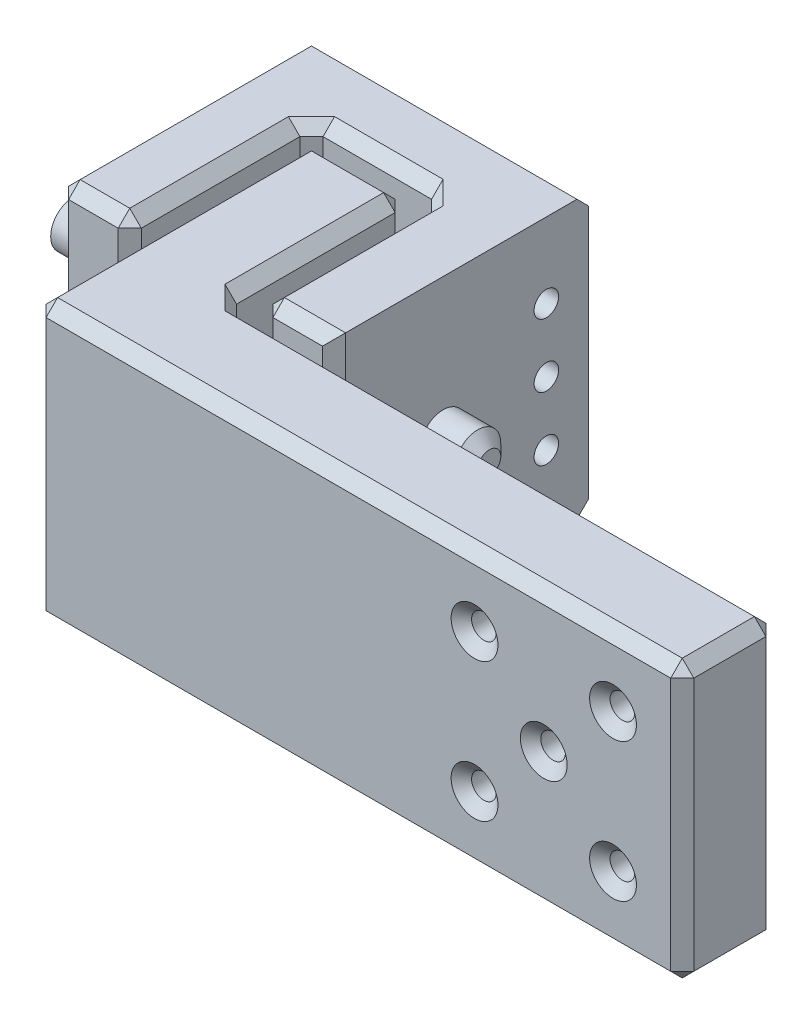
from build123d import *

# Parameters (mm, degrees)
BOSS_EXTRUDE1_DEPTH                            = 76.2
BOSS_EXTRUDE1_2_DEPTH                          = 76.2
CUT_EXTRUDE1_DEPTH                             = 229.027805322
CUT_EXTRUDE1_DEPTH_BACK                        = 229.027805322
SKETCH3_R                                      = 6.35
CHAMFER1_SIZE                                  = 6.35
CHAMFER2_SIZE                                  = 3.175
CHAMFER3_SIZE                                  = 3.175
CHAMFER4_SIZE                                  = 3.175
CSK_FOR_1_4_FLAT_HEAD_MACHINE_SCREW_2_COUNT    = 2
CSK_FOR_1_4_FLAT_HEAD_MACHINE_SCREW_2_PITCH    = 26.940768363
CSK_FOR_1_4_FLAT_HEAD_MACHINE_SCREW_3_COUNT    = 2
CSK_FOR_1_4_FLAT_HEAD_MACHINE_SCREW_3_PITCH    = 38.1
CSK_FOR_1_4_FLAT_HEAD_MACHINE_SCREW_4_COUNT    = 2
CSK_FOR_1_4_FLAT_HEAD_MACHINE_SCREW_4_PITCH    = 53.881536726
CSK_FOR_1_4_FLAT_HEAD_MACHINE_SCREW_5_COUNT    = 2
CSK_FOR_1_4_FLAT_HEAD_MACHINE_SCREW_5_PITCH    = 38.1
SKETCH7_R                                      = 6.35
BOSS_EXTRUDE2_DEPTH                            = 88.9
BOSS_EXTRUDE3_START                            = 25.4
SKETCH7_2_R                                    = 6.35
BOSS_EXTRUDE3_DEPTH                            = 25.4
CSK_FOR_1_4_FLAT_HEAD_MACHINE_SCREW_6_AT_COUNT = 2
CSK_FOR_1_4_FLAT_HEAD_MACHINE_SCREW_6_AT_PITCH = 17.4625
CSK_FOR_1_4_FLAT_HEAD_MACHINE_SCREW_7_COUNT    = 2
CSK_FOR_1_4_FLAT_HEAD_MACHINE_SCREW_7_PITCH    = 34.925
CHAMFER5_SIZE                                  = 3.175


with BuildPart() as part:
    # Sketch1 → Boss-Extrude1 (new body)
    with BuildSketch(Plane(origin=(0, 0, 0), x_dir=(1, 0, 0), z_dir=(0, 1, 0))):
        Polygon((0, 0), (0, 50), (36.2, 50), (36.2, 0), (56.2, 0), (56.2, 70), (-20, 70), (-20, 0), align=None)
    extrude(amount=BOSS_EXTRUDE1_DEPTH)


with BuildPart() as body_2:
    # Sketch1 → Boss-Extrude1 2 (new body)
    with BuildSketch(Plane(origin=(0, 0, 0), x_dir=(1, 0, 0), z_dir=(0, 1, 0))):
        Polygon((31.2, 45), (5, 45), (5, -31.2), (183.2, -31.2), (183.2, -5), (31.2, -5), align=None)
    extrude(amount=BOSS_EXTRUDE1_2_DEPTH)


with BuildPart() as cut_extrude1_tool:
    # Sketch3 → Cut-Extrude1 (new, two sides: drawn at the far end of the back side and taken through both)
    with BuildSketch(Plane.ZY.offset(20).offset(-CUT_EXTRUDE1_DEPTH_BACK)):
        with Locations((-30, 38.1)):
            Circle(SKETCH3_R)
    extrude(amount=CUT_EXTRUDE1_DEPTH + CUT_EXTRUDE1_DEPTH_BACK)


with BuildPart() as part_1:
    add(part.part)

    # Cut-Extrude1: cut by cut_extrude1_tool
    add(cut_extrude1_tool.part, mode=Mode.SUBTRACT)

    # Chamfer1
    chamfer1_edges = [part_1.edges().sort_by_distance(p)[0] for p in [
        (-20, 38.1, -36.35),
    ]]
    chamfer(chamfer1_edges, length=CHAMFER1_SIZE)

    # Chamfer3
    chamfer3_edges = [part_1.edges().sort_by_distance(p)[0] for p in [
        (36.2, 38.1, -36.35),
    ]]
    chamfer(chamfer3_edges, length=CHAMFER3_SIZE)

    # Chamfer4
    chamfer4_edges = [part_1.edges().sort_by_distance(p)[0] for p in [
        (36.2, 0, -25),
        (18.1, 0, -50),
        (0, 0, -25),
        (-10, 0, 0),
        (18.1, 76.2, -50),
        (-20, 38.1, 0),
        (-20, 38.1, -70),
        (56.2, 38.1, 0),
        (36.2, 38.1, 0),
        (36.2, 38.1, -50),
        (0, 38.1, -50),
        (0, 38.1, 0),
        (36.2, 76.2, -25),
        (46.2, 76.2, 0),
        (18.1, 76.2, -70),
        (-20, 76.2, -35),
        (-10, 76.2, 0),
        (-20, 0, -35),
        (0, 76.2, -25),
        (18.1, 0, -70),
        (46.2, 0, 0),
    ]]
    chamfer(chamfer4_edges, length=CHAMFER4_SIZE)

    # Sketch9 → CSK for 1_4 Flat Head Machine Screw  6 (revolve, cut)
    with BuildSketch(Plane(origin=(-20, 20.6375, -58.4125), x_dir=(0, 0, 1), z_dir=(0, 1, 0))):
        Polygon((0, 0), (0, 78.229827343), (3.3782, 76.2), (3.3782, 2.568232241), (6.4389, 0), align=None)
    csk_for_1_4_flat_head_machine_screw_6 = revolve(axis=Axis((-26.35, 20.6375, -58.4125), (1, 0, 0)), mode=Mode.SUBTRACT)

    # CSK for 1_4 Flat Head Machine Screw 6 at: CSK for 1_4 Flat Head Machine Screw  6 ×2
    with Locations(*[(0, i * CSK_FOR_1_4_FLAT_HEAD_MACHINE_SCREW_6_AT_PITCH, 0) for i in range(1, CSK_FOR_1_4_FLAT_HEAD_MACHINE_SCREW_6_AT_COUNT)]):
        add(csk_for_1_4_flat_head_machine_screw_6, mode=Mode.SUBTRACT)

    # CSK for 1_4 Flat Head Machine Screw  7: CSK for 1_4 Flat Head Machine Screw  6 ×2
    with Locations(*[(0, i * CSK_FOR_1_4_FLAT_HEAD_MACHINE_SCREW_7_PITCH, 0) for i in range(1, CSK_FOR_1_4_FLAT_HEAD_MACHINE_SCREW_7_COUNT)]):
        add(csk_for_1_4_flat_head_machine_screw_6, mode=Mode.SUBTRACT)


with BuildPart() as body_2_1:
    add(body_2.part)

    # Cut-Extrude1: cut by cut_extrude1_tool
    add(cut_extrude1_tool.part, mode=Mode.SUBTRACT)

    # Chamfer2
    chamfer2_edges = [body_2_1.edges().sort_by_distance(p)[0] for p in [
        (5, 38.1, -36.35),
        (31.2, 38.1, -36.35),
        (31.2, 0, -20),
        (18.1, 0, -45),
        (5, 0, -6.9),
        (94.1, 0, 31.2),
        (183.2, 0, 18.1),
        (107.2, 0, 5),
        (31.2, 76.2, -20),
        (18.1, 76.2, -45),
        (5, 76.2, -6.9),
        (94.1, 76.2, 31.2),
        (183.2, 76.2, 18.1),
        (107.2, 76.2, 5),
        (31.2, 38.1, 5),
        (183.2, 38.1, 5),
        (183.2, 38.1, 31.2),
        (5, 38.1, 31.2),
        (5, 38.1, -45),
        (31.2, 38.1, -45),
    ]]
    chamfer(chamfer2_edges, length=CHAMFER2_SIZE)

    # Sketch6 → CSK for 1_4 Flat Head Machine Screw _100 (revolve, cut)
    with BuildSketch(Plane(origin=(126.05, 19.05, 31.2), x_dir=(0, -1, 0), z_dir=(1, 0, 0))):
        Polygon((0, 0), (0, 28.229827343), (3.3782, 26.2), (3.3782, 2.568232241), (6.4389, 0), align=None)
    csk_for_1_4_flat_head_machine_screw_100 = revolve(axis=Axis((126.05, 19.05, 37.55), (0, 0, -1)), mode=Mode.SUBTRACT)

    # CSK for 1_4 Flat Head Machine Screw  2: CSK for 1_4 Flat Head Machine Screw _100 ×2
    with Locations(*[Vector(0.7071067811865475, 0.7071067811865477, 0) * (i * CSK_FOR_1_4_FLAT_HEAD_MACHINE_SCREW_2_PITCH) for i in range(1, CSK_FOR_1_4_FLAT_HEAD_MACHINE_SCREW_2_COUNT)]):
        add(csk_for_1_4_flat_head_machine_screw_100, mode=Mode.SUBTRACT)

    # CSK for 1_4 Flat Head Machine Screw  3: CSK for 1_4 Flat Head Machine Screw _100 ×2
    with Locations(*[(0, i * CSK_FOR_1_4_FLAT_HEAD_MACHINE_SCREW_3_PITCH, 0) for i in range(1, CSK_FOR_1_4_FLAT_HEAD_MACHINE_SCREW_3_COUNT)]):
        add(csk_for_1_4_flat_head_machine_screw_100, mode=Mode.SUBTRACT)

    # CSK for 1_4 Flat Head Machine Screw  4: CSK for 1_4 Flat Head Machine Screw _100 ×2
    with Locations(*[Vector(0.7071067811865477, 0.7071067811865475, 0) * (i * CSK_FOR_1_4_FLAT_HEAD_MACHINE_SCREW_4_PITCH) for i in range(1, CSK_FOR_1_4_FLAT_HEAD_MACHINE_SCREW_4_COUNT)]):
        add(csk_for_1_4_flat_head_machine_screw_100, mode=Mode.SUBTRACT)

    # CSK for 1_4 Flat Head Machine Screw  5: CSK for 1_4 Flat Head Machine Screw _100 ×2
    with Locations(*[(i * CSK_FOR_1_4_FLAT_HEAD_MACHINE_SCREW_5_PITCH, 0, 0) for i in range(1, CSK_FOR_1_4_FLAT_HEAD_MACHINE_SCREW_5_COUNT)]):
        add(csk_for_1_4_flat_head_machine_screw_100, mode=Mode.SUBTRACT)


with BuildPart() as body_3:
    # Sketch7 → Boss-Extrude2 (new body)
    with BuildSketch(Plane.ZY.offset(20)):
        with Locations((-30, 38.1)):
            Circle(SKETCH7_R)
    extrude(amount=-BOSS_EXTRUDE2_DEPTH)

    # Sketch7<2> → Boss-Extrude3 (add)
    with BuildSketch(Plane.ZY.offset(20).offset(BOSS_EXTRUDE3_START)):
        with Locations((-30, 38.1)):
            Circle(SKETCH7_2_R)
    extrude(amount=-BOSS_EXTRUDE3_DEPTH)

    # Chamfer5
    chamfer5_edges = [body_3.edges().sort_by_distance(p)[0] for p in [
        (68.9, 38.1, -36.35),
    ]]
    chamfer(chamfer5_edges, length=CHAMFER5_SIZE)


solid = Compound([part_1.part, body_2_1.part, body_3.part])
